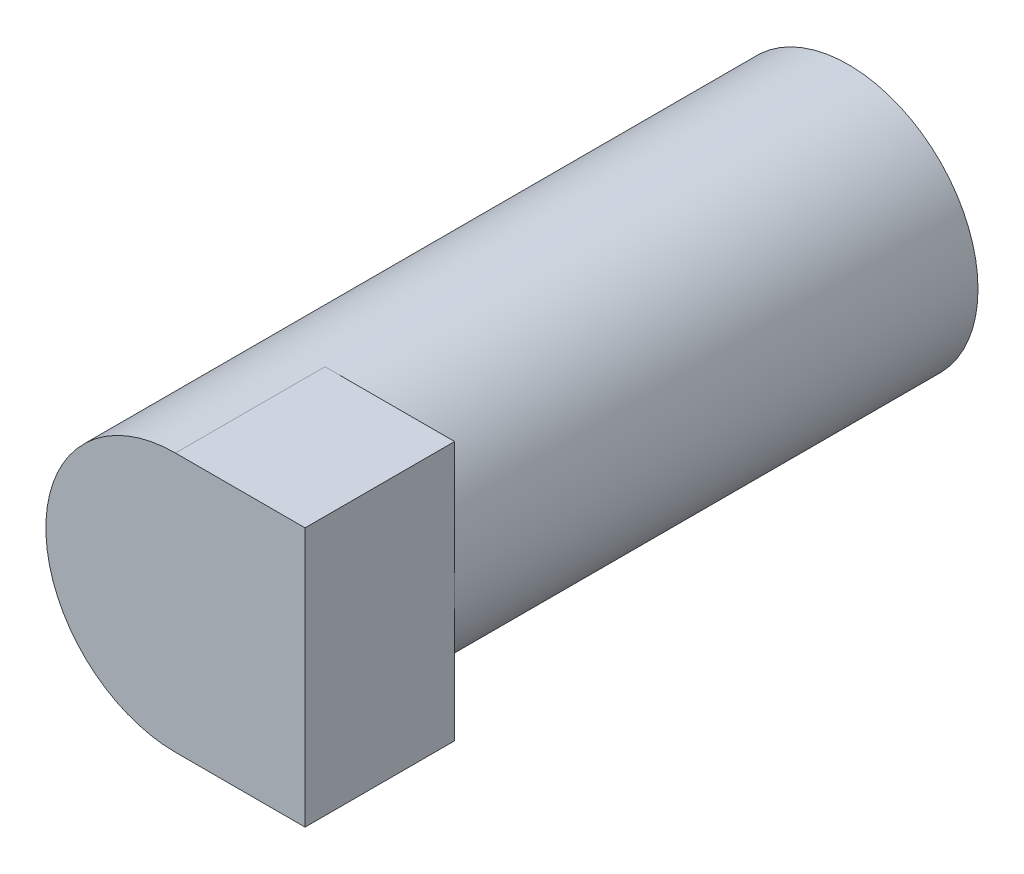
from build123d import *

# Parameters (mm, degrees)
SKETCH1_R           = 13
BOSS_EXTRUDE1_DEPTH = 67.5
SKETCH2_W           = 15
SKETCH2_H           = 26
BOSS_EXTRUDE2_DEPTH = 13


with BuildPart() as part:
    # Sketch1 → Boss-Extrude1 (new body)
    with BuildSketch(Plane.XY):
        Circle(SKETCH1_R)
    extrude(amount=BOSS_EXTRUDE1_DEPTH)

    # Sketch2 → Boss-Extrude2 (add)
    with BuildSketch(Plane(origin=(0, 0, 0), x_dir=(0, 0, -1), z_dir=(1, 0, 0))):
        with Locations((-60, 0)):
            Rectangle(SKETCH2_W, SKETCH2_H)
    extrude(amount=BOSS_EXTRUDE2_DEPTH)


solid = part.part
